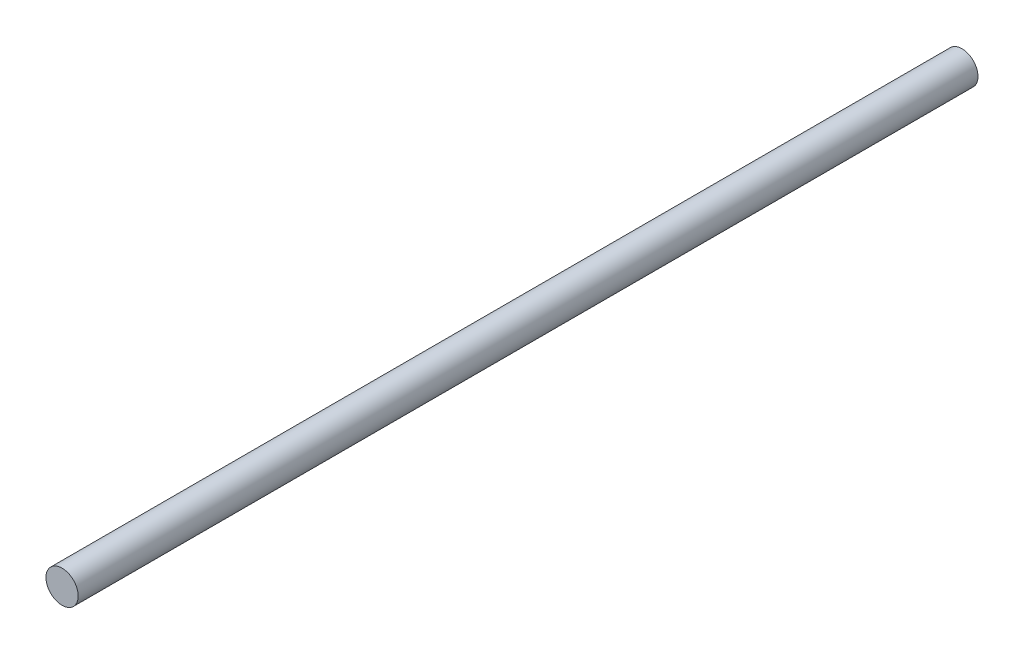
from build123d import *

# Parameters (mm, degrees)
SKETCH1_R           = 1.5
BOSS_EXTRUDE1_DEPTH = 83.82


with BuildPart() as part:
    # Sketch1 → Boss-Extrude1 (new body)
    with BuildSketch(Plane.XY):
        Circle(SKETCH1_R)
    extrude(amount=BOSS_EXTRUDE1_DEPTH)


solid = part.part
